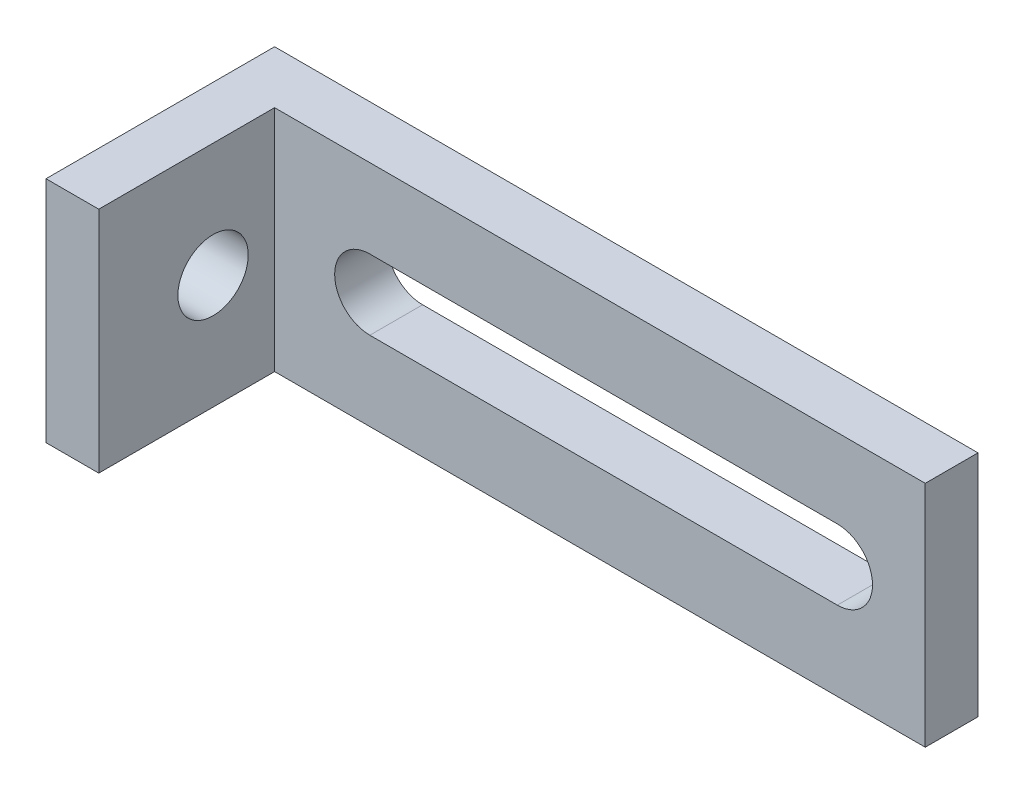
from build123d import *

# Parameters (mm, degrees)
SKETCH2_W           = 40
SKETCH2_H           = 13
BOSS_EXTRUDE1_DEPTH = 3
SKETCH3_W           = 3
SKETCH3_H           = 13
BOSS_EXTRUDE2_DEPTH = 10
SKETCH4_R           = 2
CUT_EXTRUDE1_DEPTH  = 12
CUT_EXTRUDE2_DEPTH  = 12


with BuildPart() as part:
    # Sketch2 → Boss-Extrude1 (new body)
    with BuildSketch(Plane.XY):
        Rectangle(SKETCH2_W, SKETCH2_H)
    extrude(amount=BOSS_EXTRUDE1_DEPTH)

    # Sketch3 → Boss-Extrude2 (add)
    with BuildSketch(Plane.XY.offset(3)):
        with Locations((-18.5, 0)):
            Rectangle(SKETCH3_W, SKETCH3_H)
    extrude(amount=BOSS_EXTRUDE2_DEPTH)

    # Sketch4 → Cut-Extrude1 (cut)
    with BuildSketch(Plane.ZY.offset(20)):
        with Locations((6.5, 0)):
            Circle(SKETCH4_R)
    extrude(amount=-CUT_EXTRUDE1_DEPTH, mode=Mode.SUBTRACT)

    # Sketch5 → Cut-Extrude2 (cut)
    with BuildSketch(Plane(origin=(0, 0, 0), x_dir=(-1, 0, 0), z_dir=(0, 0, -1))):
        with BuildLine():
            Line((-15, 2), (11.584611172, 2))
            ThreePointArc((11.584611172, 2), (13.584611172, 0), (11.584611172, -2))
            Line((11.584611172, -2), (-15, -2))
            ThreePointArc((-15, -2), (-17, 0), (-15, 2))
        make_face()
    extrude(amount=-CUT_EXTRUDE2_DEPTH, mode=Mode.SUBTRACT)


solid = part.part
